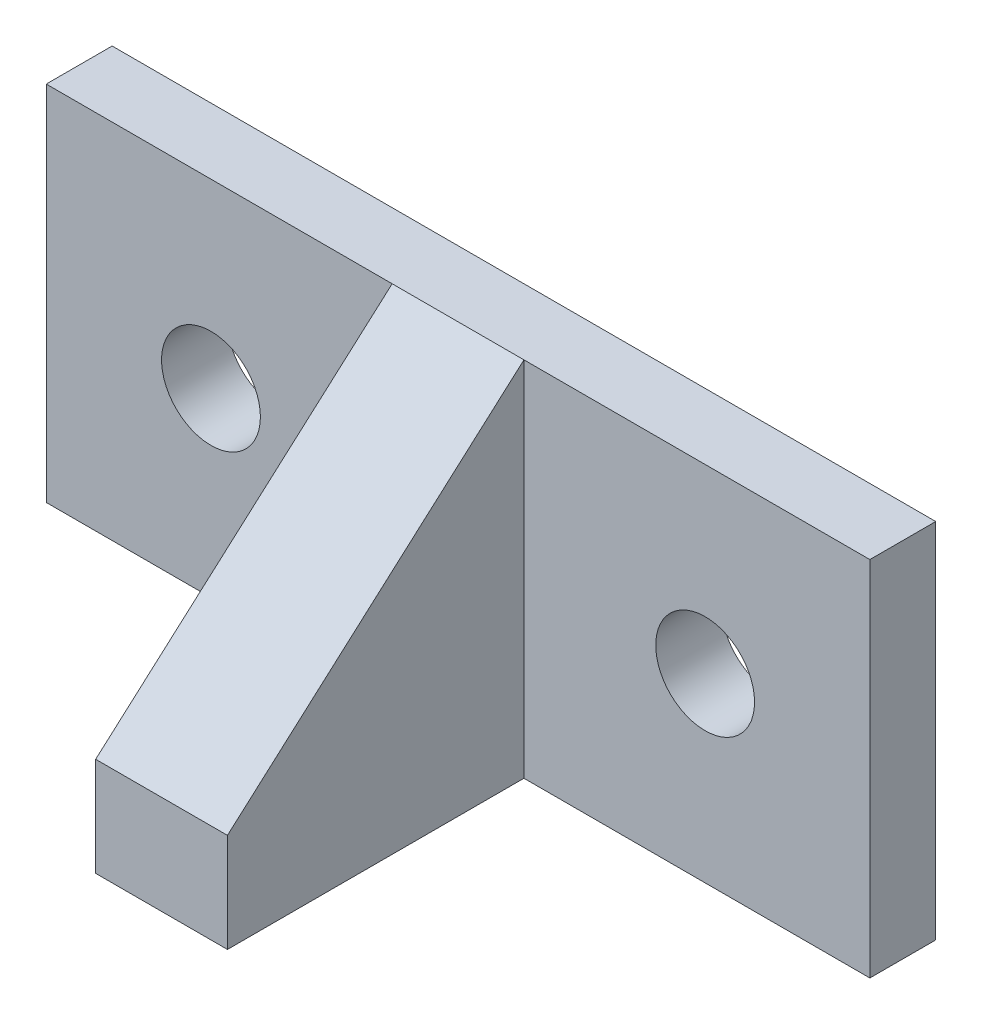
from build123d import *

# Parameters (mm, degrees)
SKETCH1_W           = 125
SKETCH1_H           = 55
SKETCH1_R           = 7.5
BOSS_EXTRUDE1_DEPTH = 10
BOSS_EXTRUDE2_DEPTH = 10


with BuildPart() as part:
    # Sketch1 → Boss-Extrude1 (new body)
    with BuildSketch(Plane.XY):
        Rectangle(SKETCH1_W, SKETCH1_H)
        with Locations((-37.5, 0)):
            Circle(SKETCH1_R, mode=Mode.SUBTRACT)
        with Locations((37.5, 0)):
            Circle(SKETCH1_R, mode=Mode.SUBTRACT)
    extrude(amount=BOSS_EXTRUDE1_DEPTH)

    # Sketch2 → Boss-Extrude2 (add, symmetric)
    with BuildSketch(Plane(origin=(0, 0, 0), x_dir=(0, 0, -1), z_dir=(1, 0, 0))):
        Polygon((0, -27.5), (-55, -27.5), (-55, -12.5), (-10, 27.5), (0, 27.5), align=None)
    extrude(amount=BOSS_EXTRUDE2_DEPTH, both=True)


solid = part.part
